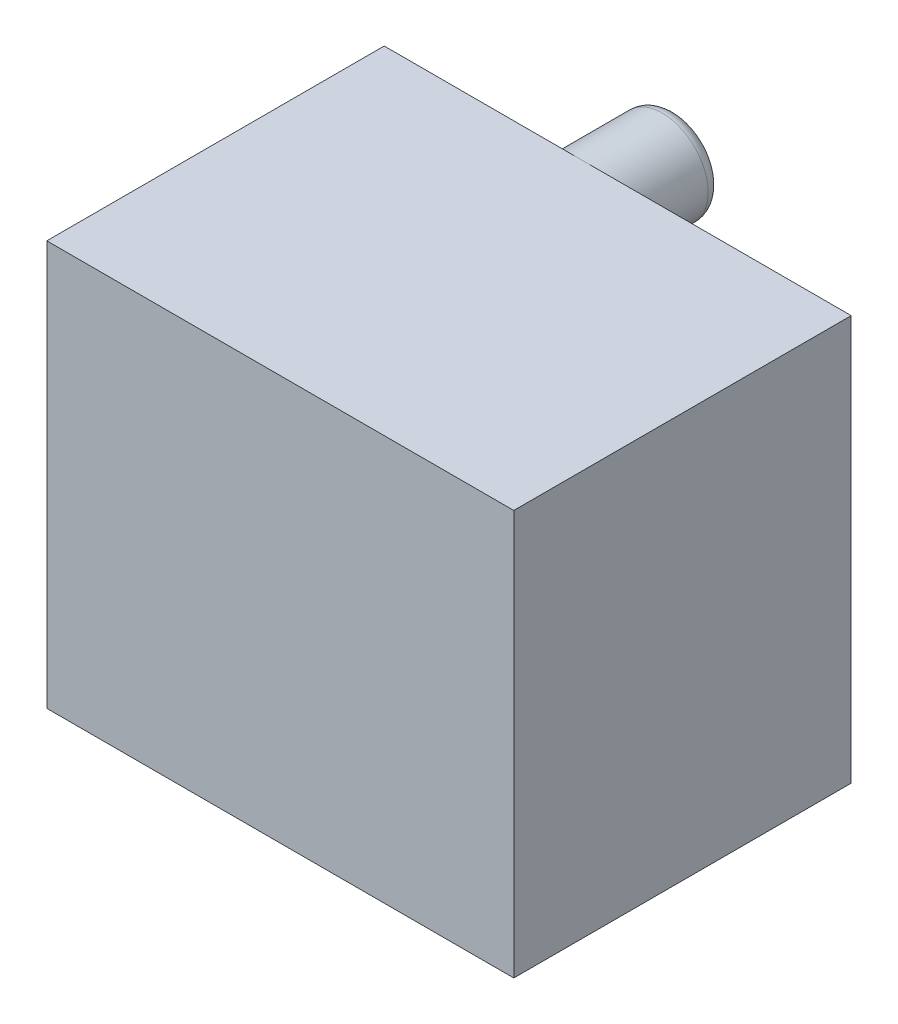
from build123d import *

# Parameters (mm, degrees)
SKETCH1_W           = 17.3
SKETCH1_H           = 15
BOSS_EXTRUDE1_DEPTH = 12.5
CUT_EXTRUDE1_DEPTH  = 15.3
SKETCH3_R           = 1.7
BOSS_EXTRUDE2_DEPTH = 3.5
FILLET1_R           = 0.5


with BuildPart() as part:
    # Sketch1 → Boss-Extrude1 (new body)
    with BuildSketch(Plane.XY):
        Rectangle(SKETCH1_W, SKETCH1_H)
    extrude(amount=BOSS_EXTRUDE1_DEPTH)

    # Sketch2 → Cut-Extrude1 (cut)
    with BuildSketch(Plane.ZY.offset(8.65)):
        Polygon((10.5, 5), (10.5, -5), (8.5, -5), (8.5, -5.7), (5.6, -5.7), (5.6, -5), (3.3, -5), (3.3, -3.5), (2, -3.5), (2, -2), (1, -2), (1, 2), (2, 2), (2, 3.5), (3.3, 3.5), (3.3, 5), (5.6, 5), (5.6, 5.7), (8.5, 5.7), (8.5, 5), align=None)
    extrude(amount=-CUT_EXTRUDE1_DEPTH, mode=Mode.SUBTRACT)

    # Sketch3 → Boss-Extrude2 (add)
    with BuildSketch(Plane(origin=(0, 0, 0), x_dir=(-1, 0, 0), z_dir=(0, 0, -1))):
        with Locations(Location((1.35, 5.8, 0), (0, 0, 180))):
            Circle(SKETCH3_R)
        with Locations(Location((1.35, -5.8, 0), (0, 0, 180))):
            Circle(SKETCH3_R)
    extrude(amount=BOSS_EXTRUDE2_DEPTH)

    # Fillet1
    fillet1_edges = [part.edges().sort_by_distance(p)[0] for p in [
        (-3.05, 5.8, -3.5),
        (-3.05, -5.8, -3.5),
    ]]
    fillet(fillet1_edges, radius=FILLET1_R)


solid = part.part
